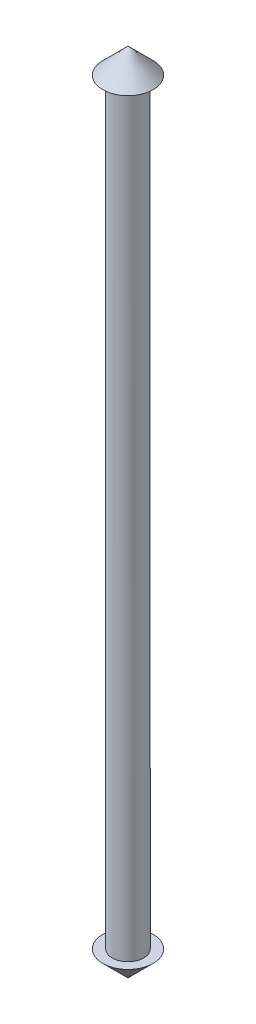
from build123d import *

# Parameters (mm, degrees)
SKETCH1_R           = 2.5
BOSS_EXTRUDE1_DEPTH = 60


with BuildPart() as part:
    # Sketch1 → Boss-Extrude1 (new, symmetric)
    with BuildSketch(Plane(origin=(0, 0, 0), x_dir=(1, 0, 0), z_dir=(0, 1, 0))):
        with Locations(Location((0, 0, 0), (0, 0, 270))):
            Circle(SKETCH1_R)
    extrude(amount=BOSS_EXTRUDE1_DEPTH, both=True)


with BuildPart() as body_2:
    # Boss-Extrude2 cone 1 section (through the dimple's axis) → Boss-Extrude2 (revolve)
    with BuildSketch(Plane(origin=(0, 60, 0), x_dir=(0, 0, -1), z_dir=(1, 0, 0))):
        Polygon((0, 0), (4, 0), (0, 4), align=None)
    revolve(axis=Axis((0, 60, 0), (0, 1, 0)))


with BuildPart() as body_3:
    # Mirror1: mirrored copy
    add(body_2.part.mirror(Plane.ZX))


with BuildPart() as part_1:
    add(part.part)

    # Combine1: union body 2, body 3
    add(body_2.part)
    add(body_3.part)


solid = part_1.part
